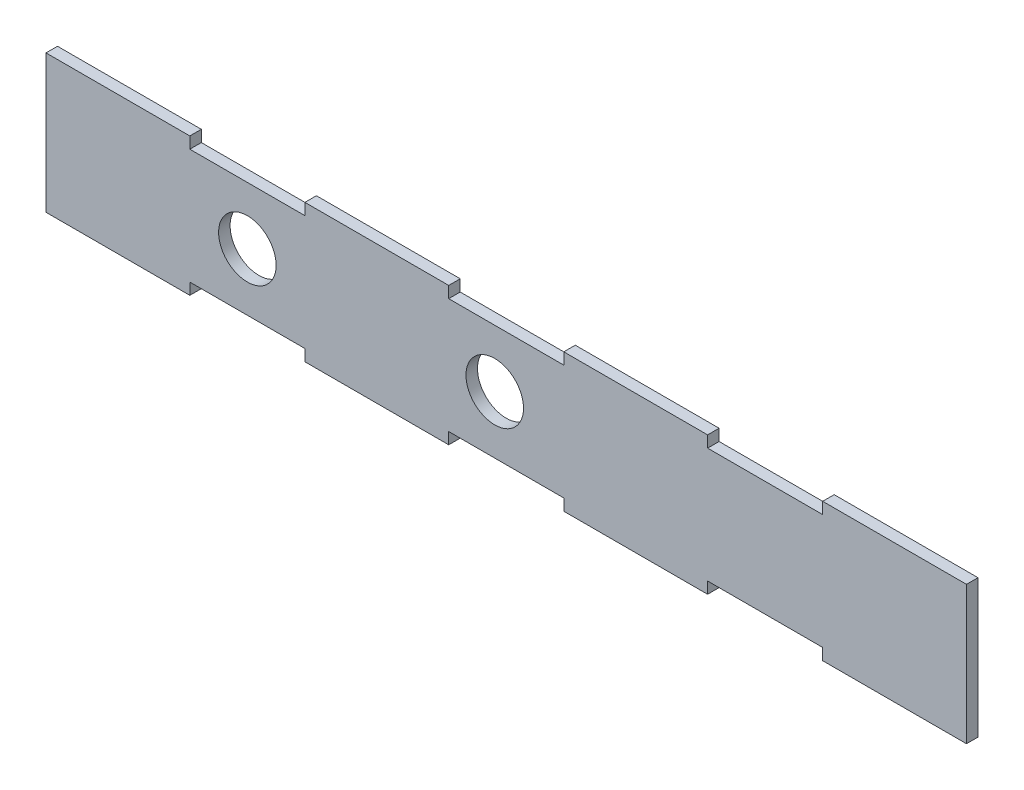
from build123d import *

# Parameters (mm, degrees)
SKETCH_1_R      = 5
EXTRUDE_1_DEPTH = 2


with BuildPart() as part:
    # Эскиз1 → Бобышка-Вытянуть1 (new body)
    with BuildSketch(Plane.XY):
        Polygon((135, 2), (135, 0), (160, 0), (160, 2), (160, 22), (160, 24), (135, 24), (135, 22), (115, 22), (115, 24), (90, 24), (90, 22), (70, 22), (70, 24), (45, 24), (45, 22), (25.389163858, 22), (25, 22), (25, 24), (21.983225621, 24), (0, 24), (0, 22), (0, 2), (0, 0), (25, 0), (25, 2), (45, 2), (45, 0), (70, 0), (70, 2), (90, 2), (90, 0), (115, 0), (115, 2), align=None)
        with Locations((35, 12)):
            Circle(SKETCH_1_R, mode=Mode.SUBTRACT)
        with Locations((78, 12)):
            Circle(SKETCH_1_R, mode=Mode.SUBTRACT)
    extrude(amount=EXTRUDE_1_DEPTH)


solid = part.part
